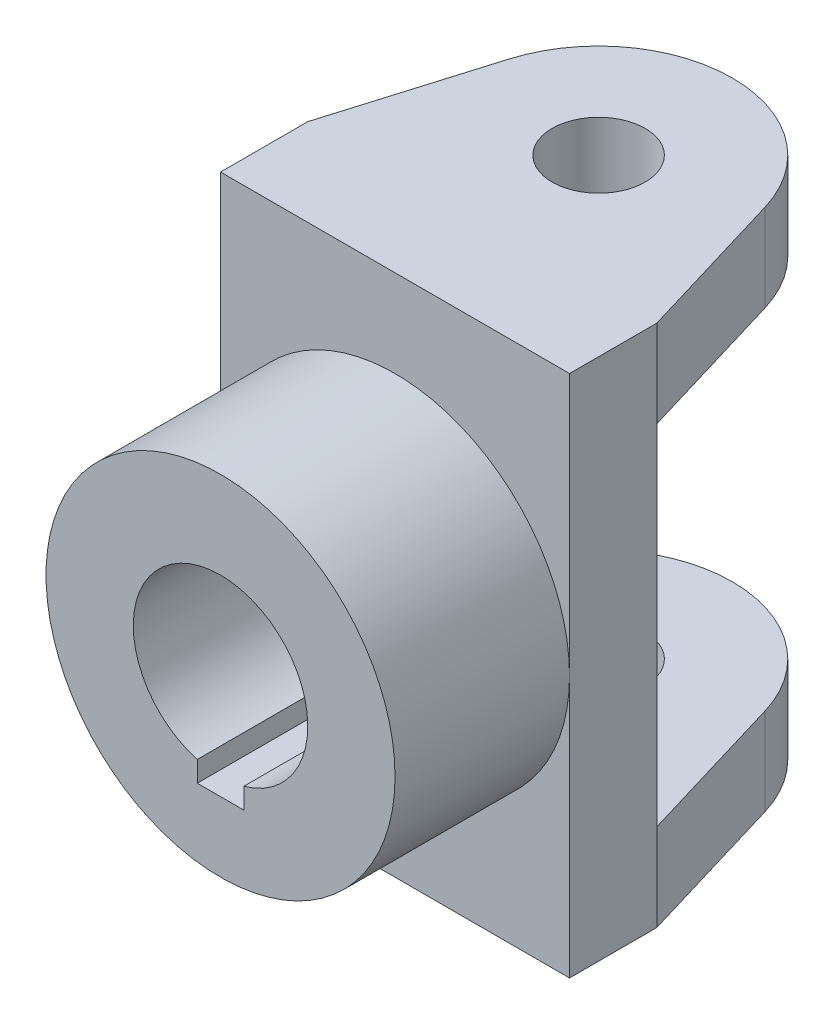
from build123d import *

# Parameters (mm, degrees)
SKETCH1_W           = 60
SKETCH1_H           = 90
BOSS_EXTRUDE2_DEPTH = 15
SKETCH2_R           = 30
BOSS_EXTRUDE4_DEPTH = 30
SKETCH3_R           = 8
BOSS_EXTRUDE5_DEPTH = 15


with BuildPart() as part:
    # Sketch1 → Boss-Extrude2 (new body)
    with BuildSketch(Plane.XY):
        Rectangle(SKETCH1_W, SKETCH1_H)
    extrude(amount=BOSS_EXTRUDE2_DEPTH)

    # Sketch2 → Boss-Extrude4 (add)
    with BuildSketch(Plane.XY.offset(15)):
        Circle(SKETCH2_R)
        with BuildLine():
            Line((-4, -14.456832295), (-4, -18))
            Line((-4, -18), (4, -18))
            Line((4, -18), (4, -14.456832295))
            ThreePointArc((4, -14.456832295), (0, 15), (-4, -14.456832295))
        make_face(mode=Mode.SUBTRACT)
    extrude(amount=BOSS_EXTRUDE4_DEPTH)

    # Sketch3 → Boss-Extrude5 (add)
    with BuildSketch(Plane(origin=(0, 45, 0), x_dir=(1, 0, 0), z_dir=(0, 1, 0))):
        with BuildLine():
            Line((11.357816692, 0), (30, 0))
            Line((30, 0), (22.03289839, 26.599347585))
            ThreePointArc((22.03289839, 26.599347585), (0, 43), (-22.03289839, 26.599347585))
            Line((-22.03289839, 26.599347585), (-30, 0))
            Line((-30, 0), (-11.357816692, 0))
            Line((-11.357816692, 0), (11.357816692, 0))
        make_face()
        with Locations(Location((0, 20, 0), (0, 0, 180))):
            Circle(SKETCH3_R, mode=Mode.SUBTRACT)
    boss_extrude5 = extrude(amount=-BOSS_EXTRUDE5_DEPTH)

    # Mirror1: Boss-Extrude5 across plane
    add(boss_extrude5.mirror(Plane.ZX))


solid = part.part
